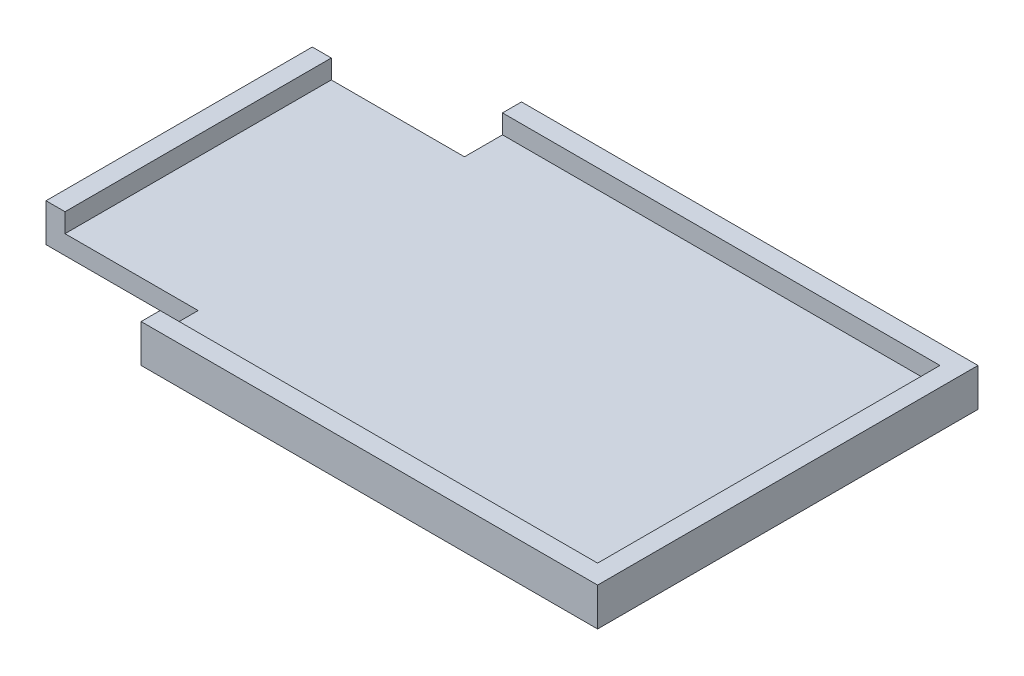
from build123d import *

# Parameters (mm, degrees)
BOSS_EXTRUDE1_DEPTH = 12.7
SKETCH2_W           = 190.5
SKETCH2_H           = 114.3
CUT_EXTRUDE1_DEPTH  = 6.35


with BuildPart() as part:
    # Sketch1 → Boss-Extrude1 (new body)
    with BuildSketch(Plane(origin=(0, 0, 0), x_dir=(1, 0, 0), z_dir=(0, 1, 0))):
        Polygon((-101.6, 44.45), (-50.8, 44.45), (-50.8, 63.5), (101.6, 63.5), (101.6, -63.5), (-50.8, -63.5), (-50.8, -44.45), (-101.6, -44.45), align=None)
    extrude(amount=BOSS_EXTRUDE1_DEPTH)

    # Sketch2 → Cut-Extrude1 (cut)
    with BuildSketch(Plane(origin=(0, 12.7, 0), x_dir=(1, 0, 0), z_dir=(0, 1, 0))):
        Rectangle(SKETCH2_W, SKETCH2_H)
    extrude(amount=-CUT_EXTRUDE1_DEPTH, mode=Mode.SUBTRACT)


solid = part.part
